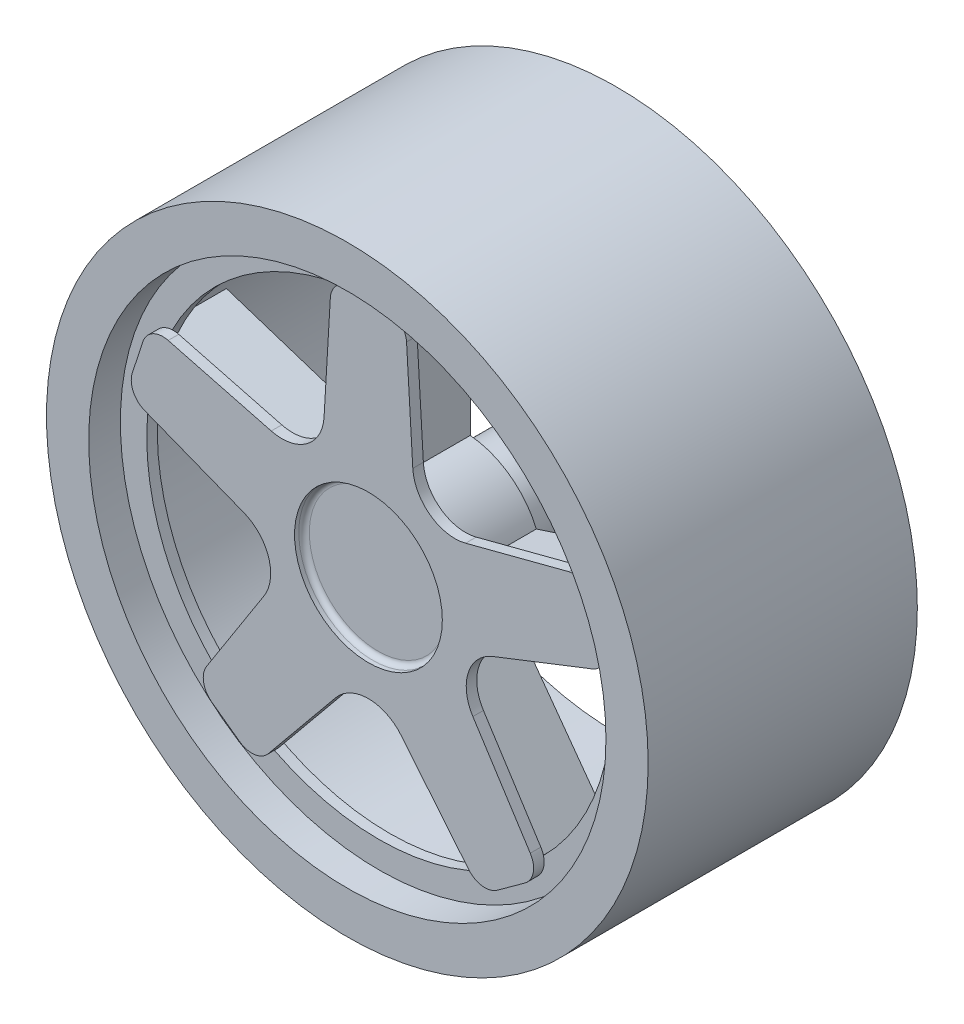
from build123d import *

# Parameters (mm, degrees)
SKETCH1_R                = 24.5
SKETCH1_R_2              = 22
BOSS_EXTRUDE1_DEPTH      = 1
BOSS_EXTRUDE2_DEPTH      = 1
SKETCH3_R                = 7
CUT_EXTRUDE1_DEPTH       = 0.9
FILLET1_R                = 0.5
BOSS_EXTRUDE3_DEPTH      = 4
BOSS_EXTRUDE3_DEPTH_BACK = 21.5
SKETCH4_R                = 28.5
SKETCH4_R_2              = 24.5
BOSS_EXTRUDE4_DEPTH      = 8
SKETCH6_R                = 4.6
BOSS_EXTRUDE5_DEPTH      = 17.5


with BuildPart() as part:
    # Sketch1 → Boss-Extrude1 (new body)
    with BuildSketch(Plane.XY):
        Circle(SKETCH1_R)
        Circle(SKETCH1_R_2, mode=Mode.SUBTRACT)
    extrude(amount=BOSS_EXTRUDE1_DEPTH)

    # Sketch2 → Boss-Extrude2 (add)
    with BuildSketch(Plane.XY.offset(1)):
        with BuildLine():
            Line((-1.614189839, 23), (1.614189839, 23))
            ThreePointArc((1.614189839, 23), (2.986252504, 22.455143994), (3.610738586, 21.117444044))
            Line((3.610738586, 21.117444044), (4.203159318, 11.046291601))
            ThreePointArc((4.203159318, 11.046291601), (5.845115801, 8.045111712), (9.206799949, 7.410933888))
            Line((9.206799949, 7.410933888), (18.96810318, 9.959665548))
            ThreePointArc((18.96810318, 9.959665548), (20.433308247, 9.779116009), (21.375487782, 8.642576636))
            Line((21.375487782, 8.642576636), (22.373111967, 5.572205105))
            ThreePointArc((22.373111967, 5.572205105), (22.278913793, 4.098926202), (21.199662351, 3.091632627))
            Line((21.199662351, 3.091632627), (11.804495268, -0.583950228))
            ThreePointArc((11.804495268, -0.583950228), (9.457596034, -3.072959231), (9.893274614, -6.46608257))
            Line((9.893274614, -6.46608257), (15.333671053, -14.962032219))
            ThreePointArc((15.333671053, -14.962032219), (15.614731503, -16.411317921), (14.824967815, -17.658593889))
            Line((14.824967815, -17.658593889), (12.213153791, -19.556187853))
            ThreePointArc((12.213153791, -19.556187853), (10.782873453, -19.921868284), (9.491373297, -19.20671))
            Line((9.491373297, -19.20671), (3.092419978, -11.40719269))
            ThreePointArc((3.092419978, -11.40719269), (0, -9.944304962), (-3.092419978, -11.40719269))
            Line((-3.092419978, -11.40719269), (-9.491373297, -19.20671))
            ThreePointArc((-9.491373297, -19.20671), (-10.782873453, -19.921868284), (-12.213153791, -19.556187853))
            Line((-12.213153791, -19.556187853), (-14.824967815, -17.658593889))
            ThreePointArc((-14.824967815, -17.658593889), (-15.614731503, -16.411317921), (-15.333671053, -14.962032219))
            Line((-15.333671053, -14.962032219), (-9.893274614, -6.46608257))
            ThreePointArc((-9.893274614, -6.46608257), (-9.457596034, -3.072959231), (-11.804495268, -0.583950228))
            Line((-11.804495268, -0.583950228), (-21.199662351, 3.091632627))
            ThreePointArc((-21.199662351, 3.091632627), (-22.278913793, 4.098926202), (-22.373111967, 5.572205105))
            Line((-22.373111967, 5.572205105), (-21.375487782, 8.642576636))
            ThreePointArc((-21.375487782, 8.642576636), (-20.433308247, 9.779116009), (-18.96810318, 9.959665548))
            Line((-18.96810318, 9.959665548), (-9.206799949, 7.410933888))
            ThreePointArc((-9.206799949, 7.410933888), (-5.845115801, 8.045111712), (-4.203159318, 11.046291601))
            Line((-4.203159318, 11.046291601), (-3.610738586, 21.117444044))
            ThreePointArc((-3.610738586, 21.117444044), (-2.986252504, 22.455143994), (-1.614189839, 23))
        make_face()
    extrude(amount=BOSS_EXTRUDE2_DEPTH)

    # Sketch3 → Cut-Extrude1 (cut)
    with BuildSketch(Plane.XY.offset(2)):
        Circle(SKETCH3_R)
    extrude(amount=-CUT_EXTRUDE1_DEPTH, mode=Mode.SUBTRACT)

    # Fillet1
    fillet1_edges = [part.edges().sort_by_distance(p)[0] for p in [
        (-7, 0, 1.1),
    ]]
    fillet(fillet1_edges, radius=FILLET1_R)

    # Sketch4 → Boss-Extrude3 (add, two sides: drawn at the far end of the back side and taken through both)
    with BuildSketch(Plane.XY.offset(-BOSS_EXTRUDE3_DEPTH_BACK)):
        Circle(SKETCH4_R)
        Circle(SKETCH4_R_2, mode=Mode.SUBTRACT)
    extrude(amount=BOSS_EXTRUDE3_DEPTH + BOSS_EXTRUDE3_DEPTH_BACK)

    # Sketch5 → Boss-Extrude4 (add)
    with BuildSketch(Plane(origin=(0, 0, 1), x_dir=(-1, 0, 0), z_dir=(0, 0, -1))):
        with BuildLine():
            Line((22.451817346, 7.975399256), (22.851723851, 6.744613588))
            Line((22.851723851, 6.744613588), (7.30628104, 1.693593032))
            ThreePointArc((7.30628104, 1.693593032), (7.132923872, -2.317627458), (4.915436519, -5.664669789))
            Line((4.915436519, -5.664669789), (14.523048547, -18.888413283))
            Line((14.523048547, -18.888413283), (13.476079724, -19.649080658))
            Line((13.476079724, -19.649080658), (3.868467697, -6.425337165))
            ThreePointArc((3.868467697, -6.425337165), (0, -7.5), (-3.868467697, -6.425337165))
            Line((-3.868467697, -6.425337165), (-13.476079724, -19.649080658))
            Line((-13.476079724, -19.649080658), (-14.523048547, -18.888413283))
            Line((-14.523048547, -18.888413283), (-4.915436519, -5.664669789))
            ThreePointArc((-4.915436519, -5.664669789), (-7.132923872, -2.317627458), (-7.30628104, 1.693593032))
            Line((-7.30628104, 1.693593032), (-22.851723851, 6.744613588))
            Line((-22.851723851, 6.744613588), (-22.451817346, 7.975399256))
            Line((-22.451817346, 7.975399256), (-6.906374535, 2.9243787))
            ThreePointArc((-6.906374535, 2.9243787), (-4.408389392, 6.067627458), (-0.647062318, 7.472035222))
            Line((-0.647062318, 7.472035222), (-0.647062318, 23.817481096))
            Line((-0.647062318, 23.817481096), (0.647062318, 23.817481096))
            Line((0.647062318, 23.817481096), (0.647062318, 7.472035222))
            ThreePointArc((0.647062318, 7.472035222), (4.408389392, 6.067627458), (6.906374535, 2.9243787))
            Line((6.906374535, 2.9243787), (22.451817346, 7.975399256))
        make_face()
    extrude(amount=BOSS_EXTRUDE4_DEPTH)

    # Sketch6 → Boss-Extrude5 (add)
    with BuildSketch(Plane(origin=(0, 0, -7), x_dir=(-1, 0, 0), z_dir=(0, 0, -1))):
        Circle(SKETCH6_R)
        with BuildLine():
            Line((-2.436698586, -1.75), (2.436698586, -1.75))
            ThreePointArc((2.436698586, -1.75), (3, 0), (2.436698586, 1.75))
            Line((2.436698586, 1.75), (-2.436698586, 1.75))
            ThreePointArc((-2.436698586, 1.75), (-3, 0), (-2.436698586, -1.75))
        make_face(mode=Mode.SUBTRACT)
    extrude(amount=BOSS_EXTRUDE5_DEPTH)


solid = part.part
